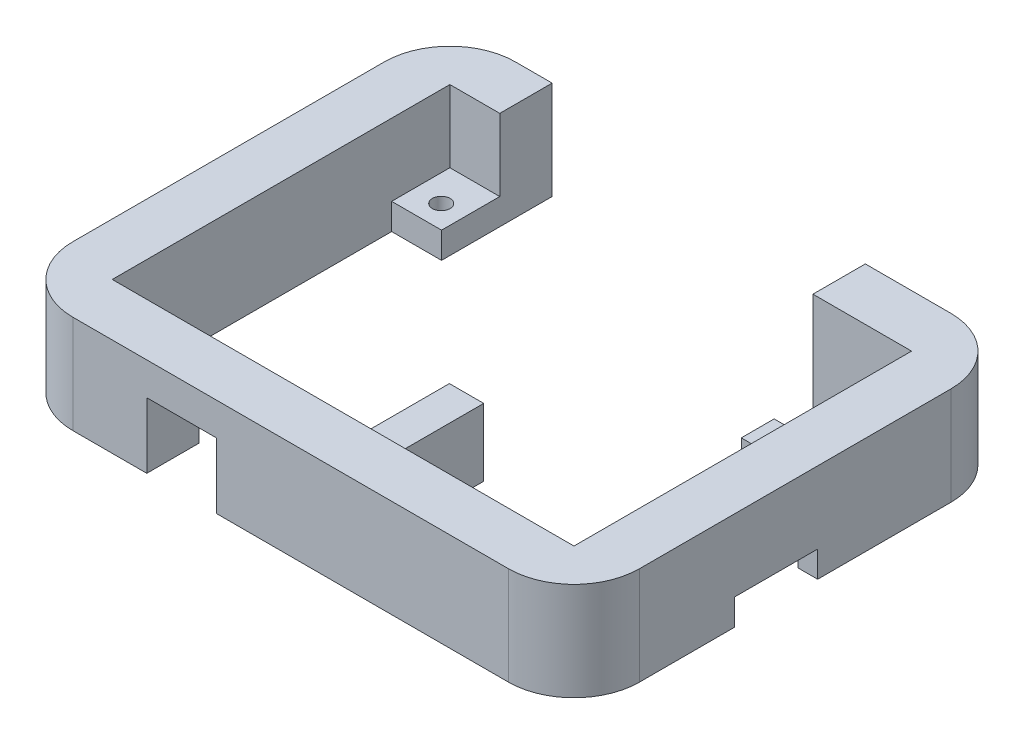
from build123d import *

# Parameters (mm, degrees)
SKETCH_2_W          = 70.5
SKETCH_2_H          = 51.55
EXTRUDE_1_DEPTH     = 15
SKETCH_3_W          = 7.62
SKETCH_3_H          = 8.89
SKETCH_3_R          = 1.35
EXTRUDE_2_DEPTH     = 4
SKETCH_4_W          = 47.8178
SKETCH_4_H          = 8
CUT_EXTRUDE_1_DEPTH = 15
SKETCH_5_W          = 5.24256
SKETCH_5_H          = 16.6727
SKETCH_5_W_2        = 6.22916
SKETCH_5_H_2        = 5.01906
EXTRUDE_3_DEPTH     = 10.3
SKETCH_7_W          = 8
SKETCH_7_H          = 12.7
CUT_EXTRUDE_4_DEPTH = 4
CUT_EXTRUDE_5_DEPTH = 2.2
SKETCH_11_W         = 10.60647
SKETCH_11_H         = 8
CUT_EXTRUDE_6_DEPTH = 10
SKETCH_12_W         = 17
SKETCH_12_H         = 3
CUT_EXTRUDE_7_DEPTH = 4


with BuildPart() as part:
    # 草图2 → 凸台-拉伸1 (new body)
    with BuildSketch(Plane(origin=(0, 0, 0), x_dir=(1, 0, 0), z_dir=(0, 1, 0))):
        with BuildLine():
            Line((-33.25, -33.775), (33.25, -33.775))
            ThreePointArc((33.25, -33.775), (40.321067812, -30.846067812), (43.25, -23.775))
            Line((43.25, -23.775), (43.25, 23.775))
            ThreePointArc((43.25, 23.775), (40.321067812, 30.846067812), (33.25, 33.775))
            Line((33.25, 33.775), (-33.25, 33.775))
            ThreePointArc((-33.25, 33.775), (-40.321067812, 30.846067812), (-43.25, 23.775))
            Line((-43.25, 23.775), (-43.25, -23.775))
            ThreePointArc((-43.25, -23.775), (-40.321067812, -30.846067812), (-33.25, -33.775))
        make_face()
        Rectangle(SKETCH_2_W, SKETCH_2_H, mode=Mode.SUBTRACT)
    extrude(amount=EXTRUDE_1_DEPTH)

    # 草图3 → 凸台-拉伸2 (add)
    # profile 1 of 2: a face of its own
    with BuildSketch(Plane(origin=(0, 0, 0), x_dir=(1, 0, 0), z_dir=(0, 1, 0))):
        with Locations((-31.44, 21.33)):
            Rectangle(SKETCH_3_W, SKETCH_3_H)
        with Locations(Location((-31.18, 20.385, 0), (0, 0, 270))):
            Circle(SKETCH_3_R, mode=Mode.SUBTRACT)
    # profile 2 of 2: a face of its own
    with BuildSketch(Plane(origin=(0, 0, 0), x_dir=(1, 0, 0), z_dir=(0, 1, 0))):
        with Locations((31.44, 21.33)):
            Rectangle(SKETCH_3_W, SKETCH_3_H)
        with Locations(Location((31.18, 20.385, 0), (0, 0, 270))):
            Circle(SKETCH_3_R, mode=Mode.SUBTRACT)
    extrude(amount=EXTRUDE_2_DEPTH)

    # 草图4 → 切除-拉伸1 (cut)
    with BuildSketch(Plane(origin=(0, 15, 0), x_dir=(1, 0, 0), z_dir=(0, 1, 0))):
        with Locations((-3.7211, 29.775)):
            Rectangle(SKETCH_4_W, SKETCH_4_H)
    extrude(amount=-CUT_EXTRUDE_1_DEPTH, mode=Mode.SUBTRACT)

    # 草图5 → 凸台-拉伸3 (add)
    with BuildSketch(Plane(origin=(0, 0, 0), x_dir=(1, 0, 0), z_dir=(0, 1, 0))):
        with Locations((2.17558, -17.43865)):
            Rectangle(SKETCH_5_W, SKETCH_5_H)
        with Locations((32.13542, 8.50953)):
            Rectangle(SKETCH_5_W_2, SKETCH_5_H_2)
    extrude(amount=EXTRUDE_3_DEPTH)

    # 草图7 → 切除-拉伸4 (cut)
    with BuildSketch(Plane.XZ):
        with Locations((39.25, 2.91792)):
            Rectangle(SKETCH_7_W, SKETCH_7_H)
    extrude(amount=-CUT_EXTRUDE_4_DEPTH, mode=Mode.SUBTRACT)

    # 草图9 → 切除-拉伸5 (cut)
    with BuildSketch(Plane.ZY.offset(-38.05)):
        Polygon((-23.775, 8), (23.775, 8), (23.775, 0), (-33.775, 0), (-33.775, 4), (-23.775, 4), align=None)
    extrude(amount=-CUT_EXTRUDE_5_DEPTH, mode=Mode.SUBTRACT)

    # 草图11 → 切除-拉伸6 (cut)
    with BuildSketch(Plane(origin=(0, 0, 0), x_dir=(-1, 0, 0), z_dir=(0, -1, 0))):
        with Locations((16.673805, -29.775)):
            Rectangle(SKETCH_11_W, SKETCH_11_H)
    extrude(amount=-CUT_EXTRUDE_6_DEPTH, mode=Mode.SUBTRACT)

    # 草图12 → 切除-拉伸7 (cut)
    with BuildSketch(Plane.XZ):
        with Locations((16.773075079, 27.275)):
            Rectangle(SKETCH_12_W, SKETCH_12_H)
    extrude(amount=-CUT_EXTRUDE_7_DEPTH, mode=Mode.SUBTRACT)


solid = part.part
